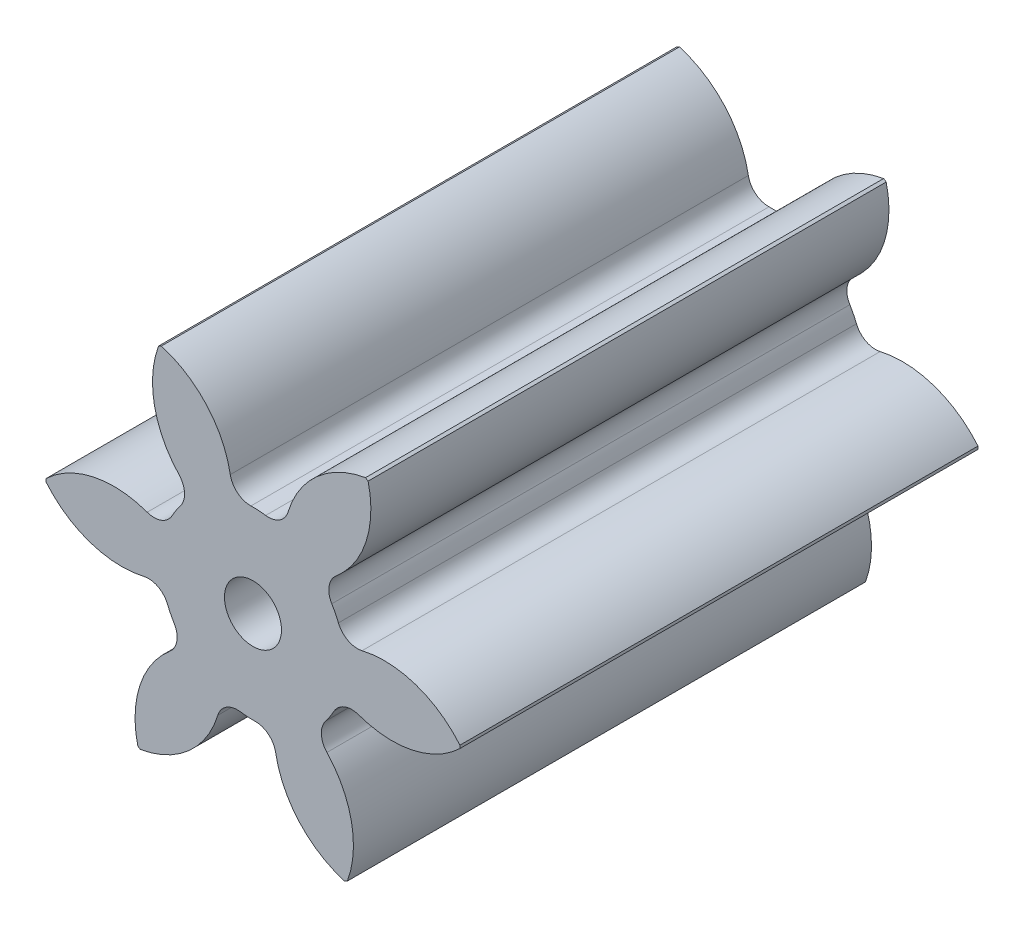
from build123d import *

# Parameters (mm, degrees)
SKETCH3_R         = 10.16
GEARBODY_DEPTH    = 25.4
TOOTHCUT_DEPTH    = 30.182378244
CIRPATTERN1_COUNT = 6
BOREDIA_R         = 1.396999992
BORE_DEPTH        = 12700


with BuildPart() as part:
    # Sketch3 → gearBody (new body)
    with BuildSketch(Plane.XY):
        Circle(SKETCH3_R)
    extrude(amount=GEARBODY_DEPTH)

    # Sketch2 → toothCut (cut, through all)
    with BuildSketch(Plane.XY):
        with BuildLine():
            ThreePointArc((3.5660378, -2.779320753), (3.777485663, -2.484321137), (3.964589271, -2.17331115))
            ThreePointArc((3.964589271, -2.17331115), (4.48964051, -1.716767841), (5.185396213, -1.710885794))
            ThreePointArc((5.185396213, -1.710885794), (8.833530023, -1.552224601), (11.322719982, 1.119476546))
            ThreePointArc((11.322719982, 1.119476546), (9.506315779, -6.251973755), (3.457461034, -10.839888317))
            ThreePointArc((3.457461034, -10.839888317), (4.924531858, -7.495974911), (3.625050385, -4.083438967))
            ThreePointArc((3.625050385, -4.083438967), (3.354836271, -3.442272117), (3.5660378, -2.779320753))
        make_face()
    toothcut = extrude(amount=TOOTHCUT_DEPTH, mode=Mode.SUBTRACT)

    # CirPattern1: toothCut ×6 about axis
    cirpattern1_axis = Axis((0, 0, 25.4), (0, 0, -1))
    for i in range(1, CIRPATTERN1_COUNT):
        add(toothcut.rotate(cirpattern1_axis, i * 360 / CIRPATTERN1_COUNT), mode=Mode.SUBTRACT)

    # boreDia → bore (cut, symmetric)
    with BuildSketch(Plane.XY):
        Circle(BOREDIA_R)
    extrude(amount=BORE_DEPTH, both=True, mode=Mode.SUBTRACT)


solid = part.part
